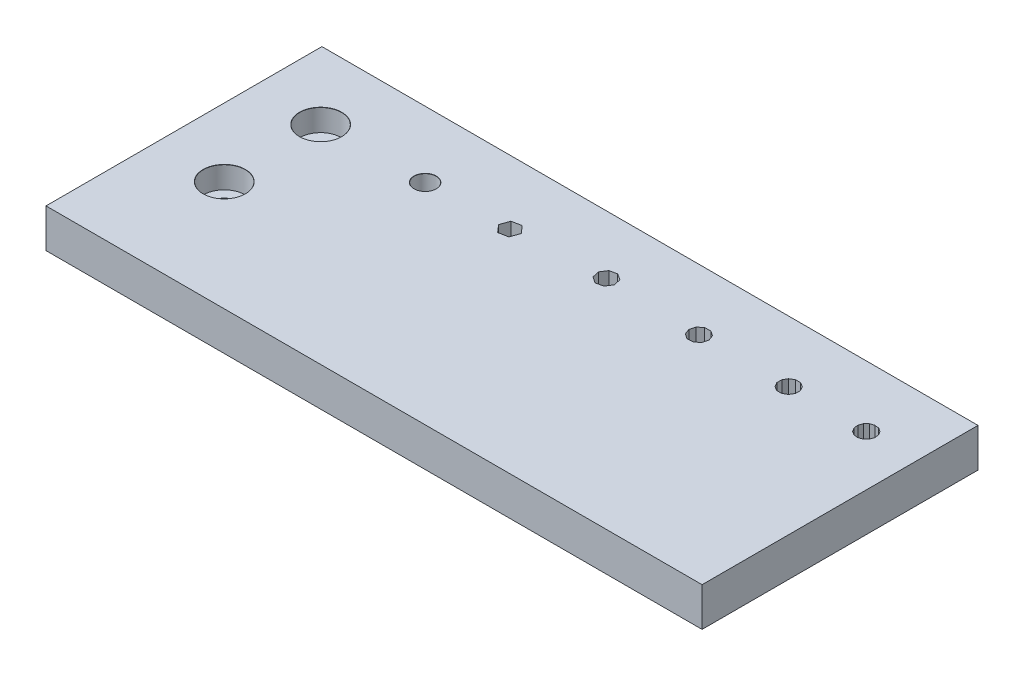
from build123d import *

# Parameters (mm, degrees)
SKETCH1_W                      = 101.6
SKETCH1_H                      = 42.727601577
BOSS_EXTRUDE2_DEPTH            = 6
M3_CLEARANCE_HOLE1_D           = 3.4
M3_CLEARANCE_HOLE1_CSINK_D     = 3.45
M3_CLEARANCE_HOLE1_CSINK_ANGLE = 90
CUT_EXTRUDE1_DEPTH             = 77.129253004
CUT_EXTRUDE2_DEPTH             = 77.129253004


with BuildPart() as part:
    # Sketch1 → Boss-Extrude2 (new body)
    with BuildSketch(Plane(origin=(0, 0, 0), x_dir=(1, 0, 0), z_dir=(0, 1, 0))):
        with Locations((-9.585511853, -24.606332138)):
            Rectangle(SKETCH1_W, SKETCH1_H)
    extrude(amount=BOSS_EXTRUDE2_DEPTH)

    # Sketch5 → CBORE for M3 Hex Socket Head Cap Screw1 (revolve, cut)
    with BuildSketch(Plane(origin=(-50.044280369, 6, 13.782297963), x_dir=(0, 0, 1), z_dir=(1, 0, 0))):
        Polygon((0, 0), (0, 6), (1.6, 6), (1.6, 3.4), (3.25, 3.4), (3.25, 0.025), (3.275, 0), align=None)
    revolve(axis=Axis((-50.044280369, 12.35, 13.782297963), (0, -1, 0)), mode=Mode.SUBTRACT)

    # Sketch8 → CBORE for M3 Hex Socket Head Cap Screw2 (revolve, cut)
    with BuildSketch(Plane(origin=(-49.834104948, 6, 28.914928265), x_dir=(0, 0, 1), z_dir=(1, 0, 0))):
        Polygon((0, 0), (0, 6), (1.7, 6), (1.7, 3.4), (3.25, 3.4), (3.25, 0.025), (3.275, 0), align=None)
    revolve(axis=Axis((-49.834104948, 12.35, 28.914928265), (0, -1, 0)), mode=Mode.SUBTRACT)

    # M3 Clearance Hole1 (through all)
    with Locations(Plane(origin=(0, 6, 0), x_dir=(1, 0, 0), z_dir=(0, 1, 0))):
        with Locations((-34.176036094, -13.467034832)):
            CounterSinkHole(M3_CLEARANCE_HOLE1_D / 2, M3_CLEARANCE_HOLE1_CSINK_D / 2, counter_sink_angle=M3_CLEARANCE_HOLE1_CSINK_ANGLE)

    # Sketch17 → Cut-Extrude1 (cut, through all)
    with BuildSketch(Plane(origin=(0, 6, 0), x_dir=(1, 0, 0), z_dir=(0, 1, 0))):
        Polygon((-22.828510557, -13.43914031), (-21.847349351, -14.573742746), (-20.374174215, -14.291333434), (-19.882160285, -12.874321687), (-20.863321491, -11.739719251), (-22.336496627, -12.022128562), align=None)
    extrude(amount=-CUT_EXTRUDE1_DEPTH, mode=Mode.SUBTRACT)

    # Sketch18 → Cut-Extrude2 (cut, through all)
    with BuildSketch(Plane(origin=(0, 6, 0), x_dir=(1, 0, 0), z_dir=(0, 1, 0))):
        Polygon((-6.426767494, -13.535213432), (-5.799321109, -12.573792338), (-6.035476891, -11.45029337), (-6.996897984, -10.822846985), (-8.120396952, -11.059002767), (-8.747843337, -12.02042386), (-8.511687556, -13.143922829), (-7.550266462, -13.771369213), align=None)
        Polygon((8.704589907, -13.535213432), (8.955713542, -12.642823133), (8.634342974, -11.773257447), (7.863230836, -11.258660909), (6.936915756, -11.295591908), (6.209218611, -11.869944056), (5.958094976, -12.762334355), (6.279465545, -13.631900041), (7.050577683, -14.146496579), (7.976892762, -14.10956558), align=None)
        Polygon((22.401860914, -13.771369213), (22.795252298, -13.101944907), (22.801227077, -12.32551076), (22.418184314, -11.650111674), (21.748760007, -11.25672029), (20.97232586, -11.250745511), (20.296926775, -11.633788275), (19.903535391, -12.303212581), (19.897560612, -13.079646728), (20.280603376, -13.755045814), (20.950027682, -14.148437198), (21.726461829, -14.154411977), align=None)
        Polygon((34.168977745, -13.977066564), (34.643623673, -13.507650611), (34.867592928, -12.878780301), (34.796525653, -12.215011111), (34.444497593, -11.647810671), (33.881232222, -11.289519984), (33.218291156, -11.211102914), (32.586978002, -11.428090924), (32.112332074, -11.897506877), (31.888362819, -12.526377187), (31.959430094, -13.190146377), (32.311458154, -13.757346817), (32.874723525, -14.115637504), (33.537664591, -14.194054574), align=None)
    extrude(amount=-CUT_EXTRUDE2_DEPTH, mode=Mode.SUBTRACT)


solid = part.part
